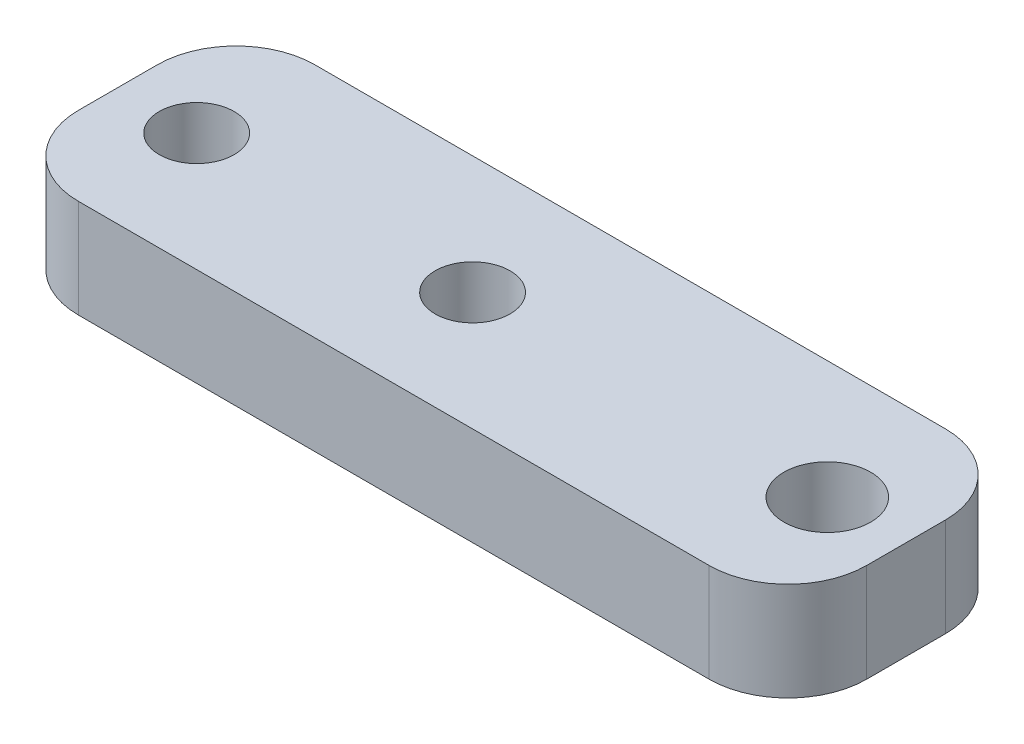
from build123d import *

# Parameters (mm, degrees)
SKETCH_1_W          = 20
SKETCH_1_H          = 6
EXTRUDE_1_DEPTH     = 2.5
SKETCH_2_R          = 1.1
SKETCH_2_R_2        = 0.95
CUT_EXTRUDE_1_DEPTH = 31.72599184
FILLET_1_R          = 2


with BuildPart() as part:
    # 草图1 → 凸台-拉伸1 (new body)
    with BuildSketch(Plane(origin=(0, 0, 0), x_dir=(1, 0, 0), z_dir=(0, 1, 0))):
        with Locations((20.030593976, 3)):
            Rectangle(SKETCH_1_W, SKETCH_1_H)
    extrude(amount=EXTRUDE_1_DEPTH)

    # 草图2 → 切除-拉伸1 (cut, through all)
    with BuildSketch(Plane(origin=(0, 2.5, 0), x_dir=(1, 0, 0), z_dir=(0, 1, 0))):
        with Locations(Location((28.030593976, 3, 0), (0, 0, 270))):
            Circle(SKETCH_2_R)
        with Locations(Location((12.030593976, 3, 0), (0, 0, 270))):
            Circle(SKETCH_2_R_2)
        with Locations(Location((19.030593976, 3, 0), (0, 0, 270))):
            Circle(SKETCH_2_R_2)
    extrude(amount=-CUT_EXTRUDE_1_DEPTH, mode=Mode.SUBTRACT)

    # 圆角1
    fillet_1_edges = [part.edges().sort_by_distance(p)[0] for p in [
        (10.030593976, 1.25, -6),
        (30.030593976, 1.25, -6),
        (30.030593976, 1.25, 0),
        (10.030593976, 1.25, 0),
    ]]
    fillet(fillet_1_edges, radius=FILLET_1_R)


solid = part.part
